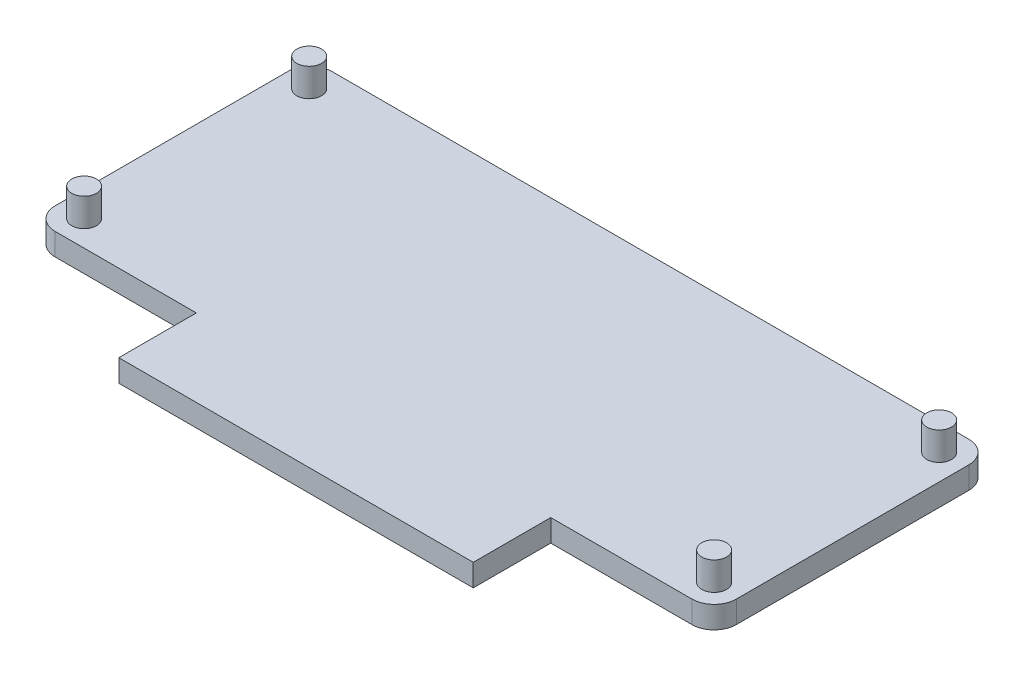
from build123d import *

# Parameters (mm, degrees)
BOSS_EXTRUDE1_DEPTH = 2
SKETCH4_R           = 1.1176
BOSS_EXTRUDE2_DEPTH = 2.54
FILLET1_R           = 2


with BuildPart() as part:
    # Sketch3 → Boss-Extrude1 (new body)
    with BuildSketch(Plane(origin=(0, 0, 0), x_dir=(1, 0, 0), z_dir=(0, 1, 0))):
        Polygon((-16, 0), (16, 0), (16, 7), (30.75, 7), (30.75, 32), (-30.75, 32), (-30.75, 7), (-16, 7), align=None)
    extrude(amount=BOSS_EXTRUDE1_DEPTH)

    # Sketch4 → Boss-Extrude2 (add)
    with BuildSketch(Plane(origin=(0, 2, 0), x_dir=(1, 0, 0), z_dir=(0, 1, 0))):
        with Locations(Location((-28.44, 9.31, 0), (0, 0, 270))):
            Circle(SKETCH4_R)
        with Locations(Location((-28.44, 29.63, 0), (0, 0, 270))):
            Circle(SKETCH4_R)
        with Locations(Location((28.44076, 29.63, 0), (0, 0, 270))):
            Circle(SKETCH4_R)
        with Locations(Location((28.44076, 9.31, 0), (0, 0, 270))):
            Circle(SKETCH4_R)
    extrude(amount=BOSS_EXTRUDE2_DEPTH)

    # Fillet1
    fillet1_edges = [part.edges().sort_by_distance(p)[0] for p in [
        (-30.75, 1, -7),
        (-30.75, 1, -32),
        (30.75, 1, -32),
        (30.75, 1, -7),
    ]]
    fillet(fillet1_edges, radius=FILLET1_R)


solid = part.part
